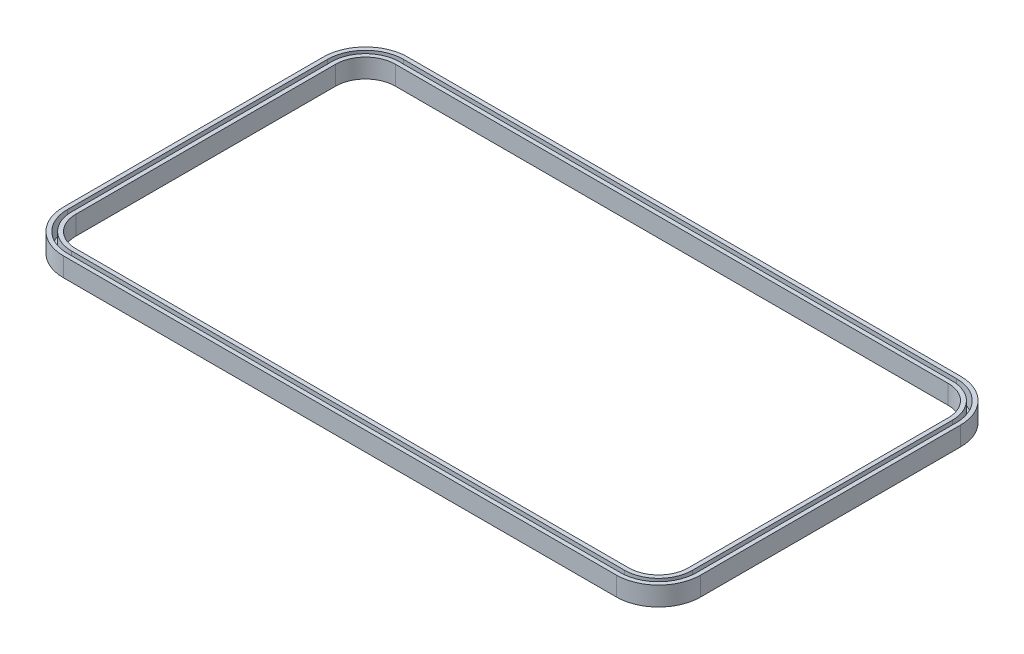
from build123d import *

# Parameters (mm, degrees)
EXTRUDE_1_DEPTH          = 11.5
CUT_EXTRUDE_1_DEPTH      = 220.099292559
CUT_EXTRUDE_1_DEPTH_BACK = 220.099292559
CUT_EXTRUDE_3_DEPTH      = 10


with BuildPart() as part:
    # 草图2 → 凸台-拉伸1 (new body)
    with BuildSketch(Plane(origin=(0, 0, 0), x_dir=(1, 0, 0), z_dir=(0, 1, 0))):
        with BuildLine():
            Line((-167, 104), (167, 104))
            ThreePointArc((167, 104), (185.03122292, 96.53122292), (192.5, 78.5))
            Line((192.5, 78.5), (192.5, -78.5))
            ThreePointArc((192.5, -78.5), (185.03122292, -96.53122292), (167, -104))
            Line((167, -104), (-167, -104))
            ThreePointArc((-167, -104), (-185.03122292, -96.53122292), (-192.5, -78.5))
            Line((-192.5, -78.5), (-192.5, 78.5))
            ThreePointArc((-192.5, 78.5), (-185.03122292, 96.53122292), (-167, 104))
        make_face()
    extrude(amount=EXTRUDE_1_DEPTH)

    # 草图3 → 切除-拉伸1 (cut, two sides: drawn at the far end of the back side and taken through both)
    with BuildSketch(Plane(origin=(0, 11.5, 0), x_dir=(1, 0, 0), z_dir=(0, 1, 0)).offset(-CUT_EXTRUDE_1_DEPTH_BACK)):
        with BuildLine():
            Line((-167, 96.5), (167, 96.5))
            ThreePointArc((167, 96.5), (179.727922061, 91.227922061), (185, 78.5))
            Line((185, 78.5), (185, -78.5))
            ThreePointArc((185, -78.5), (179.727922061, -91.227922061), (167, -96.5))
            Line((167, -96.5), (-167, -96.5))
            ThreePointArc((-167, -96.5), (-179.727922061, -91.227922061), (-185, -78.5))
            Line((-185, -78.5), (-185, 78.5))
            ThreePointArc((-185, 78.5), (-179.727922061, 91.227922061), (-167, 96.5))
        make_face()
    extrude(amount=CUT_EXTRUDE_1_DEPTH + CUT_EXTRUDE_1_DEPTH_BACK, mode=Mode.SUBTRACT)

    # 草图6 → 切除-拉伸3 (cut)
    with BuildSketch(Plane(origin=(0, 11.5, 0), x_dir=(1, 0, 0), z_dir=(0, 1, 0))):
        with BuildLine():
            Line((-167, 101.5), (167, 101.5))
            ThreePointArc((167, 101.5), (183.263455967, 94.763455967), (190, 78.5))
            Line((190, 78.5), (190, -78.5))
            ThreePointArc((190, -78.5), (183.263455967, -94.763455967), (167, -101.5))
            Line((167, -101.5), (-167, -101.5))
            ThreePointArc((-167, -101.5), (-183.263455967, -94.763455967), (-190, -78.5))
            Line((-190, -78.5), (-190, 78.5))
            ThreePointArc((-190, 78.5), (-183.263455967, 94.763455967), (-167, 101.5))
        make_face()
        with BuildLine():
            Line((-167, 99), (167, 99))
            ThreePointArc((167, 99), (181.495689014, 92.995689014), (187.5, 78.5))
            Line((187.5, 78.5), (187.5, -78.5))
            ThreePointArc((187.5, -78.5), (181.495689014, -92.995689014), (167, -99))
            Line((167, -99), (-167, -99))
            ThreePointArc((-167, -99), (-181.495689014, -92.995689014), (-187.5, -78.5))
            Line((-187.5, -78.5), (-187.5, 78.5))
            ThreePointArc((-187.5, 78.5), (-181.495689014, 92.995689014), (-167, 99))
        make_face(mode=Mode.SUBTRACT)
    extrude(amount=-CUT_EXTRUDE_3_DEPTH, mode=Mode.SUBTRACT)


solid = part.part
